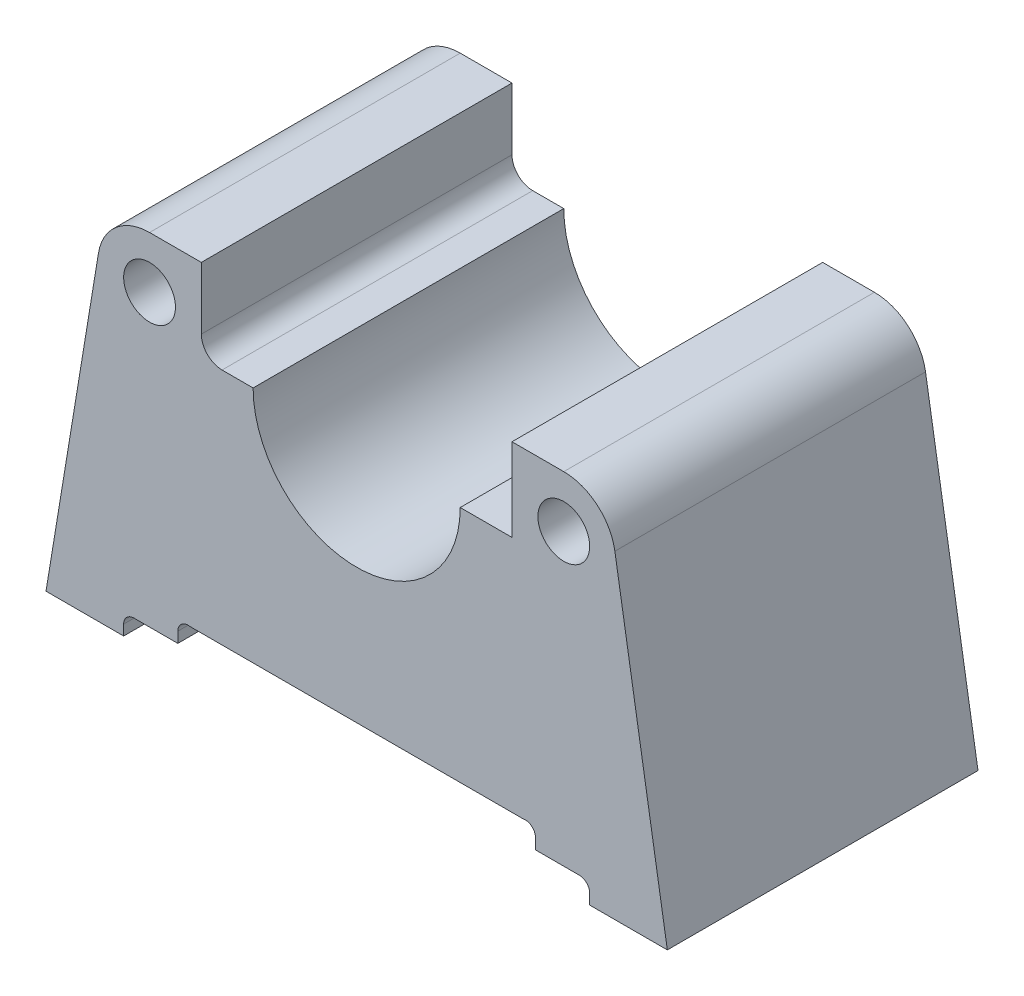
from build123d import *

# Parameters (mm, degrees)
SKETCH1_R           = 2.5
BOSS_EXTRUDE1_DEPTH = 15


with BuildPart() as part:
    # Sketch1 → Boss-Extrude1 (new, symmetric)
    with BuildSketch(Plane.XY):
        with BuildLine():
            ThreePointArc((16.060946061, 4), (16.899910262, 3.800538423), (17.271733188, 3.022468012))
            Line((17.271733188, 3.022468012), (17.271733188, 2))
            Line((17.271733188, 2), (21.5, 2))
            ThreePointArc((21.5, 2), (22.207106781, 1.707106781), (22.5, 1))
            Line((22.5, 1), (22.5, 0))
            Line((22.5, 0), (30, 0))
            Line((30, 0), (24.933748499, 30.8112495))
            ThreePointArc((24.933748499, 30.8112495), (23.236027851, 33.811577593), (20, 35))
            Line((20, 35), (15, 35))
            Line((15, 35), (15, 29))
            Line((15, 29), (15, 27))
            Line((15, 27), (13, 27))
            Line((13, 27), (10, 27))
            ThreePointArc((10, 27), (0, 17), (-10, 27))
            Line((-10, 27), (-13, 27))
            ThreePointArc((-13, 27), (-14.414213562, 27.585786438), (-15, 29))
            Line((-15, 29), (-15, 35))
            Line((-15, 35), (-20, 35))
            ThreePointArc((-20, 35), (-23.236027851, 33.811577593), (-24.933748499, 30.8112495))
            Line((-24.933748499, 30.8112495), (-30, 0))
            Line((-30, 0), (-22.5, 0))
            Line((-22.5, 0), (-22.5, 1))
            ThreePointArc((-22.5, 1), (-22.207106781, 1.707106781), (-21.5, 2))
            Line((-21.5, 2), (-17.271733188, 2))
            Line((-17.271733188, 2), (-17.271733188, 3.022468012))
            ThreePointArc((-17.271733188, 3.022468012), (-16.899910262, 3.800538423), (-16.060946061, 4))
            Line((-16.060946061, 4), (16.060946061, 4))
        make_face()
        with Locations((-20, 30)):
            Circle(SKETCH1_R, mode=Mode.SUBTRACT)
        with Locations((20, 30)):
            Circle(SKETCH1_R, mode=Mode.SUBTRACT)
    extrude(amount=BOSS_EXTRUDE1_DEPTH, both=True)


solid = part.part
